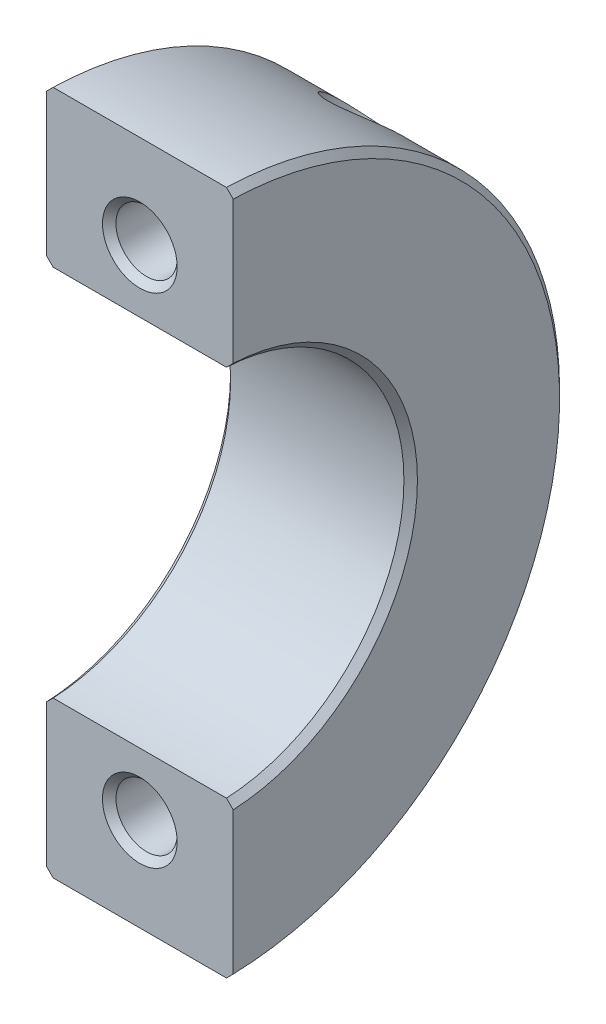
from build123d import *

# Parameters (mm, degrees)
BOSS_EXTRUDE1_DEPTH = 15
CUT_EXTRUDE1_DEPTH  = 42.676582154
HOLE1_D             = 4.917
HOLE1_DEPTH         = 26.75
CHAMFER1_SIZE       = 0.5415


with BuildPart() as part:
    # Sketch1 → Boss-Extrude1 (new body)
    with BuildSketch(Plane(origin=(7.5, 0, 0), x_dir=(0, 0, -1), z_dir=(1, 0, 0))):
        with BuildLine():
            Line((0.75, 27.489770825), (0.75, -27.489770825))
            ThreePointArc((0.75, -27.489770825), (27.5, 0), (0.75, 27.489770825))
        make_face()
    extrude(amount=-BOSS_EXTRUDE1_DEPTH)

    # Sketch2 → Cut-Extrude1 (cut, through all)
    with BuildSketch(Plane.ZY.offset(7.5)):
        with BuildLine():
            Line((-0.75, -14.981238267), (-0.75, 14.981238267))
            ThreePointArc((-0.75, 14.981238267), (-15, 0), (-0.75, -14.981238267))
        make_face()
    extrude(amount=-CUT_EXTRUDE1_DEPTH, mode=Mode.SUBTRACT)

    # Hole1
    with Locations(Plane.XY.offset(-0.75)):
        with Locations((0, -20), (0, 20)):
            Hole(HOLE1_D / 2, depth=HOLE1_DEPTH)

    # Chamfer1
    chamfer1_edges = [part.edges().sort_by_distance(p)[0] for p in [
        (7.5, 0, -15),
        (-7.5, 0, -15),
        (2.4585, 20, -0.75),
        (2.4585, -20, -0.75),
        (7.5, 0, -27.5),
        (-7.5, 0, -27.5),
    ]]
    chamfer(chamfer1_edges, length=CHAMFER1_SIZE)


solid = part.part
